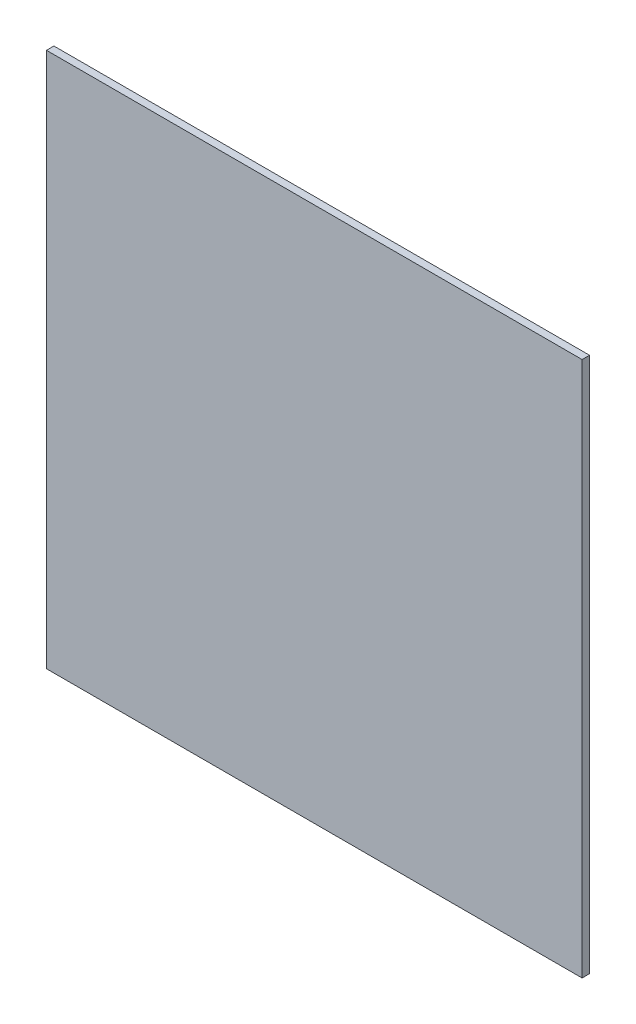
from build123d import *

# Parameters (mm, degrees)
SKETCH1_W           = 457.2
SKETCH1_H           = 457.2
BOSS_EXTRUDE1_DEPTH = 6.35


with BuildPart() as part:
    # Sketch1 → Boss-Extrude1 (new body)
    with BuildSketch(Plane.XY):
        with Locations((81.646636302, 1298.709753019)):
            Rectangle(SKETCH1_W, SKETCH1_H)
    extrude(amount=BOSS_EXTRUDE1_DEPTH)


solid = part.part
